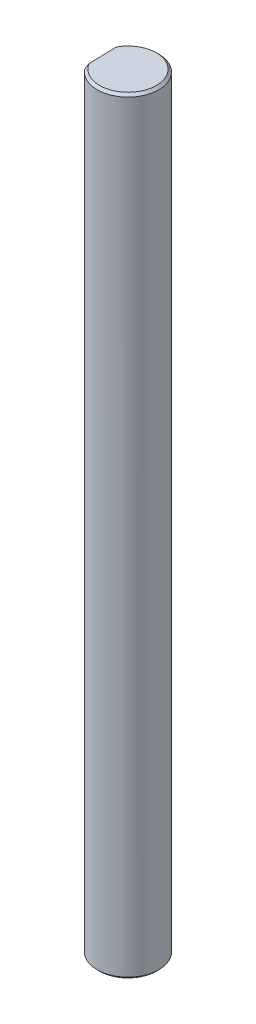
from build123d import *

# Parameters (mm, degrees)
SKETCH1_R               = 2.5
BOSS_EXTRUDE1_DEPTH     = 62.2
CUT_EXTRUDE1_DEPTH      = 63.300401283
CUT_EXTRUDE1_DEPTH_BACK = 20
CHAMFER1_SIZE           = 0.2
CHAMFER2_SIZE           = 0.2


with BuildPart() as part:
    # Sketch1 → Boss-Extrude1 (new body)
    with BuildSketch(Plane(origin=(0, 0, 0), x_dir=(1, 0, 0), z_dir=(0, 1, 0))):
        with Locations(Location((0, 0, 0), (0, 0, 90))):
            Circle(SKETCH1_R)
    extrude(amount=BOSS_EXTRUDE1_DEPTH)

    # Sketch2 → Cut-Extrude1 (cut, two sides: drawn at the far end of the back side and taken through both)
    with BuildSketch(Plane(origin=(0, 62.2, 0), x_dir=(1, 0, 0), z_dir=(0, 1, 0)).offset(-CUT_EXTRUDE1_DEPTH_BACK)):
        with BuildLine():
            Line((-2.039291674, 1.446129132), (-1.959285636, -1.55280385))
            ThreePointArc((-1.959285636, -1.55280385), (-2.499110819, -0.066671699), (-2.039291674, 1.446129132))
        make_face()
    extrude(amount=CUT_EXTRUDE1_DEPTH + CUT_EXTRUDE1_DEPTH_BACK, mode=Mode.SUBTRACT)

    # Chamfer1
    chamfer1_edges = [part.edges().sort_by_distance(p)[0] for p in [
        (2.250778713, 62.2, 1.088115429),
    ]]
    chamfer(chamfer1_edges, length=CHAMFER1_SIZE)

    # Chamfer2
    chamfer2_edges = [part.edges().sort_by_distance(p)[0] for p in [
        (0, 0, 2.5),
    ]]
    chamfer(chamfer2_edges, length=CHAMFER2_SIZE)


solid = part.part
